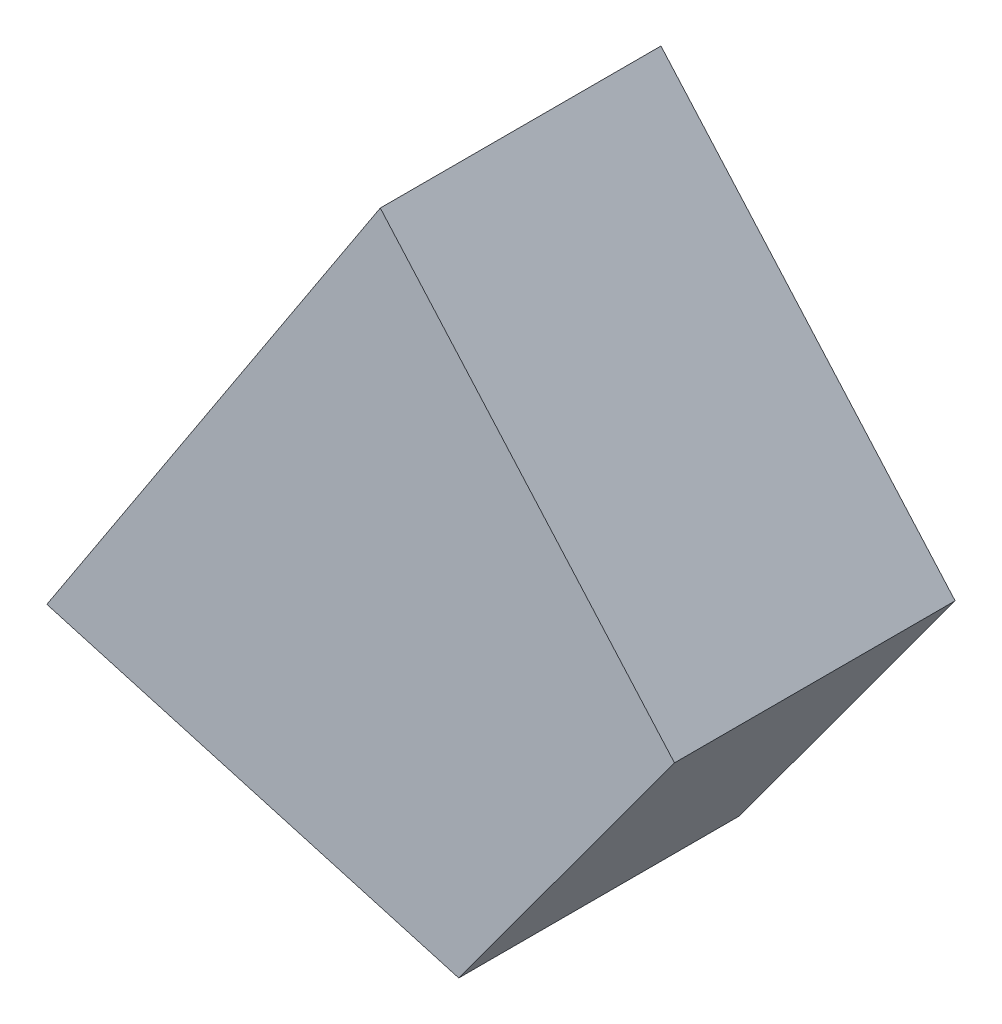
from build123d import *

# Parameters (mm, degrees)
BOSS_EXTRUDE1_DEPTH = 14.31


with BuildPart() as part:
    # Sketch1 → Boss-Extrude1 (new body)
    with BuildSketch(Plane.XY):
        Polygon((-13, -3), (8, -9), (19, 6), (4, 23), align=None)
    extrude(amount=BOSS_EXTRUDE1_DEPTH)


solid = part.part
